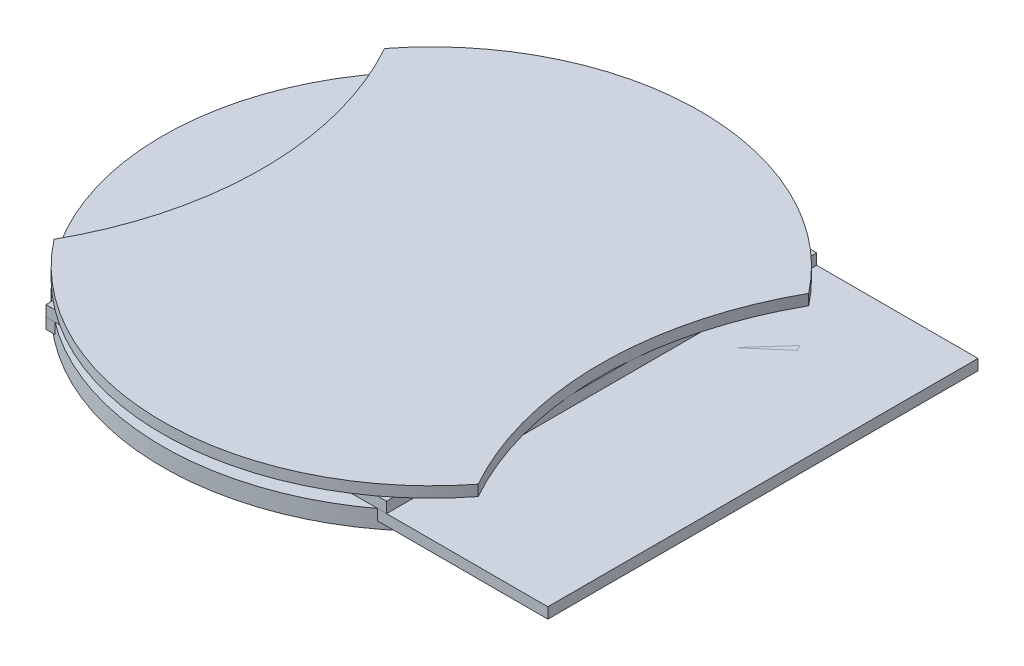
from build123d import *

# Parameters (mm, degrees)
SKETCH1_W                   = 140
SKETCH1_H                   = 120
COMPACT_DEPTH               = 3
SKETCH4_W                   = 95
SKETCH4_H                   = 120
SUPERCOMPACT_DEPTH          = 3
SKETCH7_R                   = 75
APPLE_BASE_DEPTH            = 3
SIDECUTS_DEPTH              = 195.694632694
APPLE_BASE_2_DEPTH          = 3
BOSS_EXTRUDE4_DEPTH         = 3
BASE_PLATE_FILLET_R         = 0.001
TOP_BOTTOM_EXTENSIONS_DEPTH = 3
SKETCH35_R                  = 1.25
SPACERHOLES_DEPTH           = 10
CUT_EXTRUDE4_DEPTH          = 10
SKETCH39_R                  = 75
SKETCH39_R_2                = 1.25
BOSS_EXTRUDE5_DEPTH         = 5
CUT_EXTRUDE5_DEPTH          = 150
SKETCH41_R                  = 8.5
CUT_EXTRUDE6_DEPTH          = 10
SKETCH44_R                  = 8.5
CUT_EXTRUDE7_DEPTH          = 10


with BuildPart() as part:
    # Sketch1 → Compact (new body)
    with BuildSketch(Plane(origin=(0, 0, 0), x_dir=(1, 0, 0), z_dir=(0, 1, 0))):
        with Locations((70, 60)):
            Rectangle(SKETCH1_W, SKETCH1_H)
    extrude(amount=COMPACT_DEPTH)


with BuildPart() as body_2:
    # Sketch4 → SuperCompact (new body)
    with BuildSketch(Plane(origin=(0, 3, 0), x_dir=(1, 0, 0), z_dir=(0, 1, 0))):
        with Locations((47.5, 60)):
            Rectangle(SKETCH4_W, SKETCH4_H)
    extrude(amount=SUPERCOMPACT_DEPTH)


with BuildPart() as body_3:
    # Sketch7 → Apple Base (new body)
    with BuildSketch(Plane(origin=(0, 6, 0), x_dir=(1, 0, 0), z_dir=(0, 1, 0))):
        with Locations(Location((47.5, 60, 0), (0, 0, 270))):
            Circle(SKETCH7_R)
    extrude(amount=APPLE_BASE_DEPTH)

    # Sketch8 → SideCuts (cut, through all)
    with BuildSketch(Plane(origin=(0, 9, 0), x_dir=(1, 0, 0), z_dir=(0, 1, 0))):
        with BuildLine():
            ThreePointArc((-11.66, 106.098746187), (0.350007958, 60), (-11.66, 13.901253813))
            ThreePointArc((-11.66, 13.901253813), (-27.5, 60), (-11.66, 106.098746187))
        make_face()
        with BuildLine():
            ThreePointArc((106.66, 106.098746187), (94.649992042, 60), (106.66, 13.901253813))
            ThreePointArc((106.66, 13.901253813), (122.5, 60), (106.66, 106.098746187))
        make_face()
    extrude(amount=-SIDECUTS_DEPTH, mode=Mode.SUBTRACT)


with BuildPart() as body_4:
    # Sketch9 → Apple_Base 2 (new body)
    with BuildSketch(Plane.XZ.offset(-6)):
        with BuildLine():
            ThreePointArc((106.66, -13.901253813), (47.5, 15), (-11.66, -13.901253813))
            ThreePointArc((-11.66, -13.901253813), (0.350007958, -60), (-11.66, -106.098746187))
            ThreePointArc((-11.66, -106.098746187), (47.5, -135), (106.66, -106.098746187))
            ThreePointArc((106.66, -106.098746187), (94.649992042, -60), (106.66, -13.901253813))
        make_face()
    extrude(amount=APPLE_BASE_2_DEPTH)

    # Sketch10 → Boss-Extrude4 (add)
    with BuildSketch(Plane(origin=(0, 6, 0), x_dir=(1, 0, 0), z_dir=(0, 1, 0))):
        with BuildLine():
            Line((-11.66, 106.098746187), (-11.66, 13.901253813))
            ThreePointArc((-11.66, 13.901253813), (0.350007958, 60), (-11.66, 106.098746187))
        make_face()
        with BuildLine():
            Line((106.66, 106.098746187), (106.66, 13.901253813))
            ThreePointArc((106.66, 13.901253813), (94.649992042, 60), (106.66, 106.098746187))
        make_face()
    extrude(amount=-BOSS_EXTRUDE4_DEPTH)

    # Base_Plate_Fillet
    base_plate_fillet_edges = [body_4.edges().sort_by_distance(p)[0] for p in [
        (-11.66, 3, -60),
        (-11.66, 6, -60),
        (47.5, 3, -135),
        (106.66, 3, -60),
        (106.66, 6, -60),
        (47.5, 6, -135),
        (47.5, 6, 15),
        (106.66, 4.5, -106.098746187),
        (-11.66, 4.5, -106.098746187),
        (-11.66, 4.5, -13.901253813),
        (106.66, 4.5, -13.901253813),
        (47.5, 3, 15),
    ]]
    fillet(base_plate_fillet_edges, radius=BASE_PLATE_FILLET_R)

    # Sketch25 → Top Bottom extensions (add)
    with BuildSketch(Plane(origin=(0, 6, 0), x_dir=(1, 0, 0), z_dir=(0, 1, 0))):
        with BuildLine():
            Line((-11.659005821, 106.097402592), (-11.659005821, 111.097402592))
            ThreePointArc((-11.659005821, 111.097402592), (47.5, 138.794628322), (106.659005821, 111.097402592))
            Line((106.659005821, 111.097402592), (106.659005821, 106.097402592))
            ThreePointArc((106.659005821, 106.097402592), (47.5, 133.794628322), (-11.659005821, 106.097402592))
        make_face()
        with BuildLine():
            Line((106.659005821, 13.902597408), (106.659005821, 8.902597408))
            ThreePointArc((106.659005821, 8.902597408), (47.5, -18.794628322), (-11.659005821, 8.902597408))
            Line((-11.659005821, 8.902597408), (-11.659005821, 13.902597408))
            ThreePointArc((-11.659005821, 13.902597408), (47.5, -13.794628322), (106.659005821, 13.902597408))
        make_face()
    extrude(amount=-TOP_BOTTOM_EXTENSIONS_DEPTH)

    # Sketch35 → SpacerHoles (cut)
    with BuildSketch(Plane.XZ.offset(-3)):
        with Locations(Location((7.5, -5.15, 0), (0, 0, 270))):
            Circle(SKETCH35_R)
        with Locations(Location((87.5, -5.15, 0), (0, 0, 270))):
            Circle(SKETCH35_R)
        with Locations(Location((87.5, -114.85, 0), (0, 0, 270))):
            Circle(SKETCH35_R)
        with Locations(Location((7.5, -114.85, 0), (0, 0, 270))):
            Circle(SKETCH35_R)
    extrude(amount=-SPACERHOLES_DEPTH, mode=Mode.SUBTRACT)

    # Sketch38 → Cut-Extrude4 (cut)
    with BuildSketch(Plane.XZ.offset(-3)):
        Polygon((47.5, 37.050137759), (120.372278362, 37.050137759), (120.372278362, -158.601845129), (-29.177494987, -158.601845129), (-29.177494987, 37.050137759), align=None)
        Polygon((-6.659, -60), (-6.659, 24.702355976), (101.659, 24.702355976), (101.659, -143.843523469), (-6.659, -143.843523469), align=None, mode=Mode.SUBTRACT)
    extrude(amount=-CUT_EXTRUDE4_DEPTH, mode=Mode.SUBTRACT)

    # Sketch39 → Boss-Extrude5 (add)
    with BuildSketch(Plane.XZ.offset(-3)):
        with Locations(Location((47.5, -60, 0), (0, 0, 43.770209918))):
            Circle(SKETCH39_R)
        with Locations(Location((87.5, -5.15, 0), (0, 0, 270))):
            Circle(SKETCH39_R_2, mode=Mode.SUBTRACT)
        with Locations(Location((7.5, -5.15, 0), (0, 0, 270))):
            Circle(SKETCH39_R_2, mode=Mode.SUBTRACT)
        with Locations(Location((7.5, -114.85, 0), (0, 0, 270))):
            Circle(SKETCH39_R_2, mode=Mode.SUBTRACT)
        with Locations(Location((87.5, -114.85, 0), (0, 0, 270))):
            Circle(SKETCH39_R_2, mode=Mode.SUBTRACT)
    extrude(amount=BOSS_EXTRUDE5_DEPTH)

    # Sketch40 → Cut-Extrude5 (cut)
    with BuildSketch(Plane(origin=(101.659, 0, 0), x_dir=(0, 0, -1), z_dir=(1, 0, 0))):
        Polygon((3.460058054, 3), (-22.733784582, 3), (-22.733784582, 8.214035789), (147.50303534, 8.214035789), (147.50303534, 3), align=None)
    extrude(amount=-CUT_EXTRUDE5_DEPTH, mode=Mode.SUBTRACT)

    # Sketch41 → Cut-Extrude6 (cut)
    with BuildSketch(Plane(origin=(0, 3, 0), x_dir=(1, 0, 0), z_dir=(0, 1, 0))):
        with Locations(Location((47.5, 60, 0), (0, 0, 270))):
            Circle(SKETCH41_R)
        with Locations(Location((79.7, 60, 0), (0, 0, 270))):
            Circle(SKETCH41_R)
    extrude(amount=-CUT_EXTRUDE6_DEPTH, mode=Mode.SUBTRACT)

    # Sketch44 → Cut-Extrude7 (cut)
    with BuildSketch(Plane(origin=(0, 3, 0), x_dir=(1, 0, 0), z_dir=(0, 1, 0))):
        with Locations(Location((111.7, 60, 0), (0, 0, 270))):
            Circle(SKETCH44_R)
    extrude(amount=-CUT_EXTRUDE7_DEPTH, mode=Mode.SUBTRACT)


solid = Compound([part.part, body_2.part, body_3.part, body_4.part])
